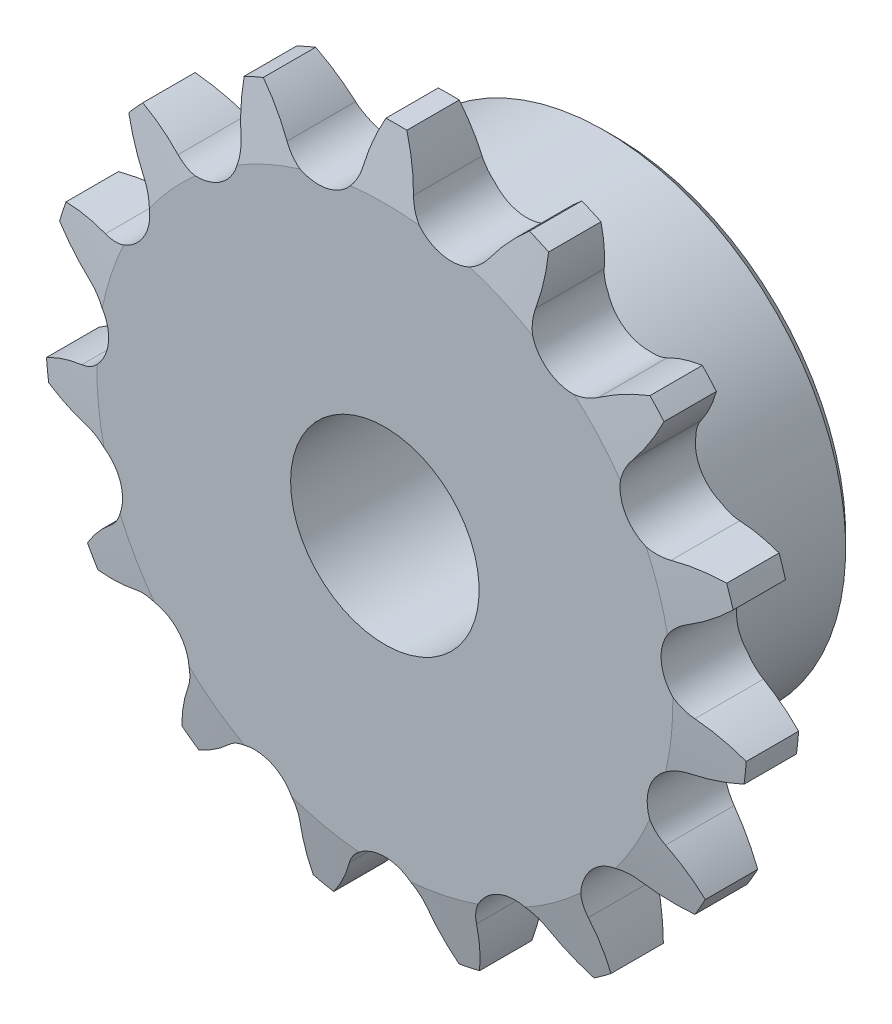
from build123d import *

# Parameters (mm, degrees)
CHAMFER1_SIZE      = 1
CUT_EXTRUDE1_DEPTH = 10
CIRPATTERN1_COUNT  = 15


with BuildPart() as part:
    # Sketch1 → Revolve1 (revolve)
    with BuildSketch(Plane(origin=(0, 0, 0), x_dir=(0, 0, -1), z_dir=(1, 0, 0)), mode=Mode.PRIVATE) as revolve1_sk:
        Polygon((0, 9), (22, 9), (22, 23), (7.2, 23), (7.2, 27.5), (6.1, 33.5), (1.1, 33.5), (0, 27.5), align=None)
    revolve(revolve1_sk.sketch.rotate(Axis((0, 0, -27.365268612), (0, 0, 1)), 90), axis=Axis((0, 0, -27.365268612), (0, 0, 1)))

    # Chamfer1
    chamfer1_edges = [part.edges().sort_by_distance(p)[0] for p in [
        (23, 0, -22),
    ]]
    chamfer(chamfer1_edges, length=CHAMFER1_SIZE)

    # Sketch2 → Cut-Extrude1 (cut)
    with BuildSketch(Plane.XY):
        with BuildLine():
            ThreePointArc((2.410291523, 29.178605232), (5.517976274, 25.960037323), (9.666097069, 27.636336154))
            ThreePointArc((9.666097069, 27.636336154), (11.066504999, 29.424770837), (12.706060036, 30.996871428))
            ThreePointArc((12.706060036, 30.996871428), (6.965041642, 32.767944625), (1, 33.485071301))
            ThreePointArc((1, 33.485071301), (1.858377139, 31.382018834), (2.410291523, 29.178605232))
        make_face()
    cut_extrude1 = extrude(amount=-CUT_EXTRUDE1_DEPTH, mode=Mode.SUBTRACT)

    # CirPattern1: Cut-Extrude1 ×15 about axis
    cirpattern1_axis = Axis((0, 0, 0), (0, 0, 1))
    for i in range(1, CIRPATTERN1_COUNT):
        add(cut_extrude1.rotate(cirpattern1_axis, i * 360 / CIRPATTERN1_COUNT), mode=Mode.SUBTRACT)


solid = part.part
